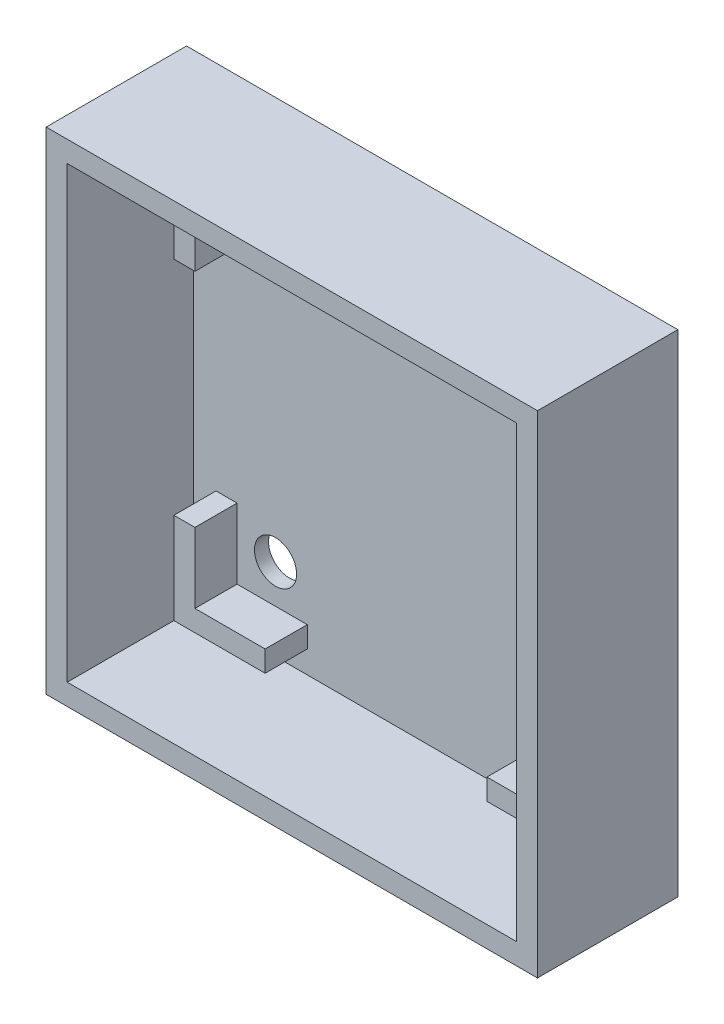
from build123d import *

# Parameters (mm, degrees)
SKETCH1_W           = 35
SKETCH1_H           = 35
BOSS_EXTRUDE1_DEPTH = 10
SKETCH2_W           = 32
SKETCH2_H           = 32
CUT_EXTRUDE1_DEPTH  = 9
BOSS_EXTRUDE2_DEPTH = 3
SKETCH5_R           = 1.5
CUT_EXTRUDE2_DEPTH  = 51.309044912


with BuildPart() as part:
    # Sketch1 → Boss-Extrude1 (new body)
    with BuildSketch(Plane.XY):
        with Locations((17.5, -17.5)):
            Rectangle(SKETCH1_W, SKETCH1_H)
    extrude(amount=BOSS_EXTRUDE1_DEPTH)

    # Sketch2 → Cut-Extrude1 (cut)
    with BuildSketch(Plane.XY.offset(10)):
        with Locations((17.5, -17.5)):
            Rectangle(SKETCH2_W, SKETCH2_H)
    extrude(amount=-CUT_EXTRUDE1_DEPTH, mode=Mode.SUBTRACT)

    # Sketch3 → Boss-Extrude2 (add)
    with BuildSketch(Plane.XY.offset(1)):
        Polygon((3.1, -3.1), (3.1, -9.6), (4.6, -9.6), (4.6, -4.6), (9.6, -4.6), (9.6, -3.1), align=None)
        Polygon((4.6, -30.4), (9.6, -30.4), (9.6, -31.9), (3.1, -31.9), (3.1, -25.4), (4.6, -25.4), align=None)
        Polygon((30.4, -30.4), (30.4, -25.4), (31.9, -25.4), (31.9, -31.9), (25.4, -31.9), (25.4, -30.4), align=None)
        Polygon((30.4, -4.6), (25.4, -4.6), (25.4, -3.1), (31.9, -3.1), (31.9, -9.6), (30.4, -9.6), align=None)
    extrude(amount=BOSS_EXTRUDE2_DEPTH)

    # Sketch5 → Cut-Extrude2 (cut, through all)
    with BuildSketch(Plane.XY.offset(1)):
        with Locations((7.34, -7.34)):
            Circle(SKETCH5_R)
        with Locations((7.34, -27.66)):
            Circle(SKETCH5_R)
        with Locations((27.66, -27.66)):
            Circle(SKETCH5_R)
        with Locations((27.66, -7.34)):
            Circle(SKETCH5_R)
    extrude(amount=-CUT_EXTRUDE2_DEPTH, mode=Mode.SUBTRACT)


solid = part.part
